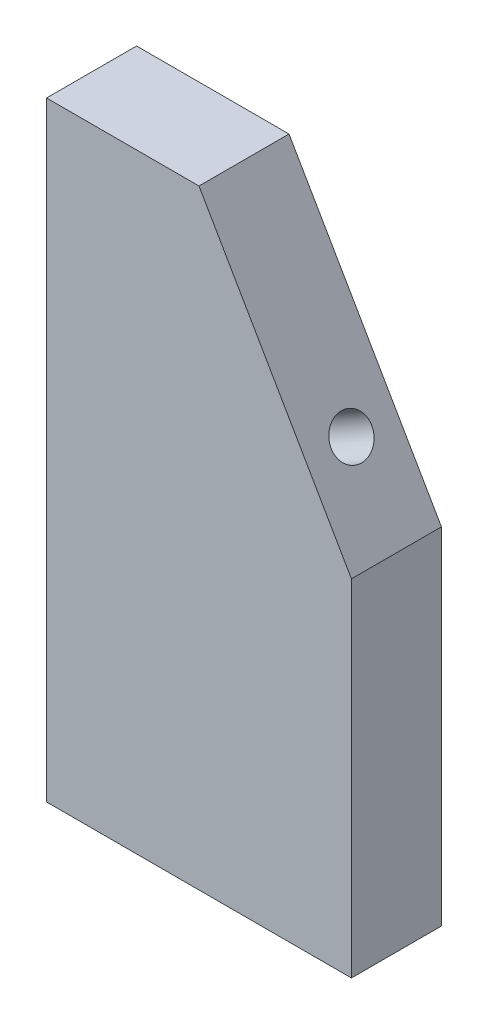
from build123d import *

# Parameters (mm, degrees)
BOSS_EXTRUDE1_DEPTH                       = 7.5
CUT_EXTRUDE1_START                        = -10
CUT_EXTRUDE1_DEPTH                        = 5.7
SKETCH5_W                                 = 3.373501
SKETCH5_H                                 = 31.997045256
CUT_EXTRUDE2_START                        = -15
CUT_EXTRUDE2_DEPTH                        = 5.7
SKETCH8_W                                 = 3.373501
SKETCH8_H                                 = 15
F_17_64_0_26563_DIAMETER_HOLE2_AT_2_COUNT = 2
F_17_64_0_26563_DIAMETER_HOLE2_AT_2_PITCH = 25.4
CUT_EXTRUDE3_DEPTH                        = 10.2


with BuildPart() as part:
    # Sketch1 → Boss-Extrude1 (new, symmetric)
    with BuildSketch(Plane.XY):
        Polygon((0, -28.802954744), (0, 28.802954744), (-25.4, 72.797045256), (-50.8, 72.797045256), (-50.8, -28.802954744), (-25.4, -28.802954744), align=None)
    extrude(amount=BOSS_EXTRUDE1_DEPTH, both=True)

    # Sketch2 → Cut-Extrude1 (cut)
    with BuildSketch(Plane(origin=(12.472045256, 7.200738686, 0), x_dir=(0, 0, -1), z_dir=(0.8660254037844379, 0.5000000000000013, 0)).offset(CUT_EXTRUDE1_START)):
        Polygon((0, 34.055117767), (5.1, 36.999604139), (5.1, 42.888576885), (5.1, 45.833063258), (0, 45.833063258), (-5.1, 45.833063258), (-5.1, 42.888576885), (-5.1, 36.999604139), align=None)
    extrude(amount=-CUT_EXTRUDE1_DEPTH, mode=Mode.SUBTRACT)

    # Sketch5 → 17/64 (0.26563) Diameter Hole1 (revolve, cut)
    with BuildSketch(Plane(origin=(-16.160254038, 36.793335801, 0), x_dir=(0.500000000000001, -0.866025403784438, 0), z_dir=(0, 0, 1))):
        with Locations((1.6867505, 15.998522628)):
            Rectangle(SKETCH5_W, SKETCH5_H)
    revolve(axis=Axis((-21.659515352, 33.618335801, 0), (0.866025403784438, 0.5000000000000009, 0)), mode=Mode.SUBTRACT)

    # Sketch6 → Cut-Extrude2 (cut)
    with BuildSketch(Plane.XZ.offset(28.802954744).offset(CUT_EXTRUDE2_START)):
        Polygon((-31.34500185, 0), (-34.722500925, 5.85), (-41.477499075, 5.85), (-44.85499815, 0), (-41.477499075, -5.85), (-34.722500925, -5.85), align=None)
        Polygon((-9.322500925, 5.85), (-16.077499075, 5.85), (-19.45499815, 0), (-16.077499075, -5.85), (-9.322500925, -5.85), (-5.94500185, 0), align=None)
    extrude(amount=-CUT_EXTRUDE2_DEPTH, mode=Mode.SUBTRACT)

    # Sketch8 → 17/64 (0.26563) Diameter Hole2 (revolve, cut)
    with BuildSketch(Plane(origin=(-12.7, -13.802954744, 0), x_dir=(0, 0, 1), z_dir=(1, 0, 0))):
        with Locations((1.6867505, 7.5)):
            Rectangle(SKETCH8_W, SKETCH8_H)
    f_17_64_0_26563_diameter_hole2 = revolve(axis=Axis((-12.7, -7.452954744, 0), (0, -1, 0)), mode=Mode.SUBTRACT)

    # 17/64 (0.26563) Diameter Hole2 at 2: 17/64 (0.26563) Diameter Hole2 ×2
    with Locations(*[(-i * F_17_64_0_26563_DIAMETER_HOLE2_AT_2_PITCH, 0, 0) for i in range(1, F_17_64_0_26563_DIAMETER_HOLE2_AT_2_COUNT)]):
        add(f_17_64_0_26563_diameter_hole2, mode=Mode.SUBTRACT)

    # Sketch9 → Cut-Extrude3 (cut)
    with BuildSketch(Plane(origin=(0, 0, 5.1), x_dir=(-1, 0, 0), z_dir=(0, 0, -1))):
        Polygon((19.104740411, 41.893335801), (24.041085212, 41.893335801), (24.041085212, 39.043335801), align=None)
    extrude(amount=CUT_EXTRUDE3_DEPTH, mode=Mode.SUBTRACT)


solid = part.part
